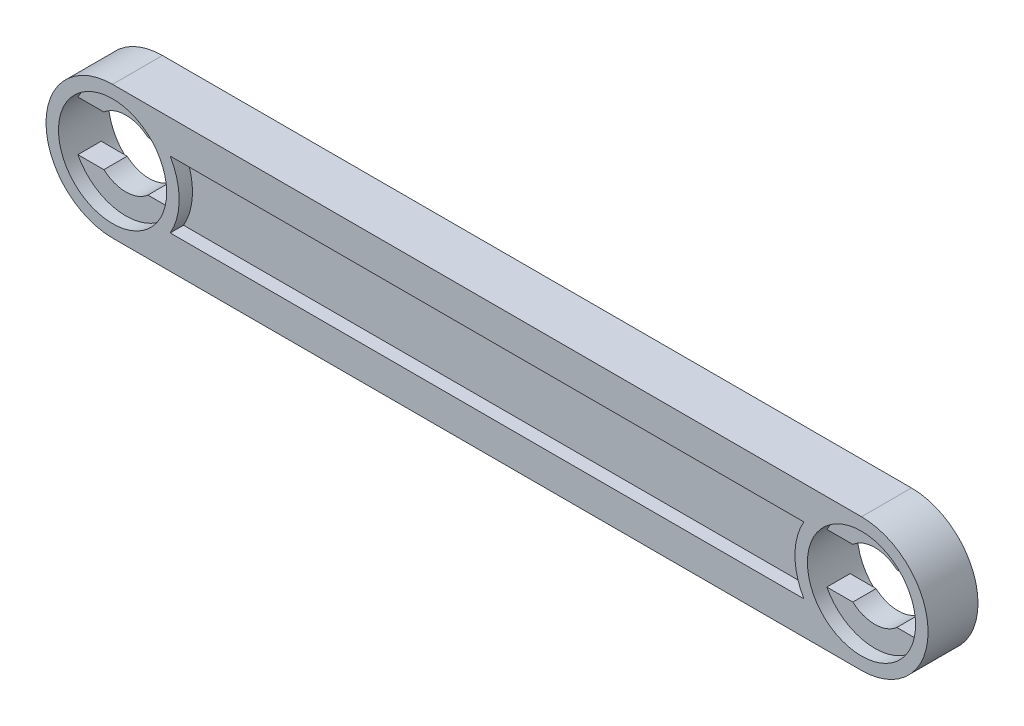
from build123d import *

# Parameters (mm, degrees)
EXTRUDE_1_DEPTH     = 3
CUT_EXTRUDE_1_REACH = 51.254
SKETCH_3_R          = 3.25
CUT_EXTRUDE_2_DEPTH = 0.8
CUT_EXTRUDE_START   = -2.2
SKETCH_3_2_R        = 3.25
CUT_EXTRUDE_3_DEPTH = 0.8
CUT_EXTRUDE_4_DEPTH = 0.8
SKETCH_5_W          = 37
SKETCH_5_H          = 4
CUT_EXTRUDE_5_DEPTH = 0.8


with BuildPart() as part:
    # 草图1 → 凸台-拉伸1 (new body)
    with BuildSketch(Plane.XY):
        with BuildLine():
            Line((0, 4), (45, 4))
            ThreePointArc((45, 4), (49, 0), (45, -4))
            Line((45, -4), (0, -4))
            ThreePointArc((0, -4), (-4, 0), (0, 4))
        make_face()
    extrude(amount=-EXTRUDE_1_DEPTH)

    # 草图2 → 切除-拉伸1 (cut, up to next)
    with BuildSketch(Plane.XY, mode=Mode.PRIVATE) as cut_extrude_1_sk1:
        with BuildLine():
            Line((1.322875656, -1.5), (2.883140649, -1.5))
            ThreePointArc((2.883140649, -1.5), (3.25, 0), (2.883140649, 1.5))
            Line((2.883140649, 1.5), (1.322875656, 1.5))
            ThreePointArc((1.322875656, 1.5), (0, 2), (-1.322875656, 1.5))
            Line((-1.322875656, 1.5), (-2.883140649, 1.5))
            ThreePointArc((-2.883140649, 1.5), (-3.25, 0), (-2.883140649, -1.5))
            Line((-2.883140649, -1.5), (-1.322875656, -1.5))
            ThreePointArc((-1.322875656, -1.5), (0, -2), (1.322875656, -1.5))
        make_face()
    cut_extrude_1_tool1 = extrude(cut_extrude_1_sk1.sketch, amount=-CUT_EXTRUDE_1_REACH, mode=Mode.PRIVATE) & part.part
    cut_extrude_1 = cut_extrude_1_tool1.solids().sort_by_distance((0, 0, 0))[0]
    add(cut_extrude_1, mode=Mode.SUBTRACT)

    # 草图3 → 切除-拉伸2 (cut)
    with BuildSketch(Plane.XY):
        Circle(SKETCH_3_R)
    cut_extrude_2 = extrude(amount=-CUT_EXTRUDE_2_DEPTH, mode=Mode.SUBTRACT)

    # 草图3<2> → 切除-拉伸3 (cut)
    with BuildSketch(Plane.XY.offset(CUT_EXTRUDE_START)):
        Circle(SKETCH_3_2_R)
    cut_extrude_3 = extrude(amount=-CUT_EXTRUDE_3_DEPTH, mode=Mode.SUBTRACT)

    # 镜向1: 切除-拉伸1, 切除-拉伸2, 切除-拉伸3 across plane
    add(cut_extrude_1.mirror(Plane(origin=(22.5, 0, 0), x_dir=(0, 0, 1), z_dir=(1, 0, 0))), mode=Mode.SUBTRACT)
    add(cut_extrude_2.mirror(Plane(origin=(22.5, 0, 0), x_dir=(0, 0, 1), z_dir=(1, 0, 0))), mode=Mode.SUBTRACT)
    add(cut_extrude_3.mirror(Plane(origin=(22.5, 0, 0), x_dir=(0, 0, 1), z_dir=(1, 0, 0))), mode=Mode.SUBTRACT)

    # 草图4 → 切除-拉伸4 (cut)
    with BuildSketch(Plane.XY):
        with BuildLine():
            Line((3.464101615, 2), (41.535898385, 2))
            ThreePointArc((41.535898385, 2), (41, 0), (41.535898385, -2))
            Line((41.535898385, -2), (3.464101615, -2))
            ThreePointArc((3.464101615, -2), (4, 0), (3.464101615, 2))
        make_face()
    extrude(amount=-CUT_EXTRUDE_4_DEPTH, mode=Mode.SUBTRACT)

    # 草图5 → 切除-拉伸5 (cut)
    with BuildSketch(Plane(origin=(0, 0, -3), x_dir=(-1, 0, 0), z_dir=(0, 0, -1))):
        with Locations((-22.5, 0)):
            Rectangle(SKETCH_5_W, SKETCH_5_H)
    extrude(amount=-CUT_EXTRUDE_5_DEPTH, mode=Mode.SUBTRACT)


solid = part.part
